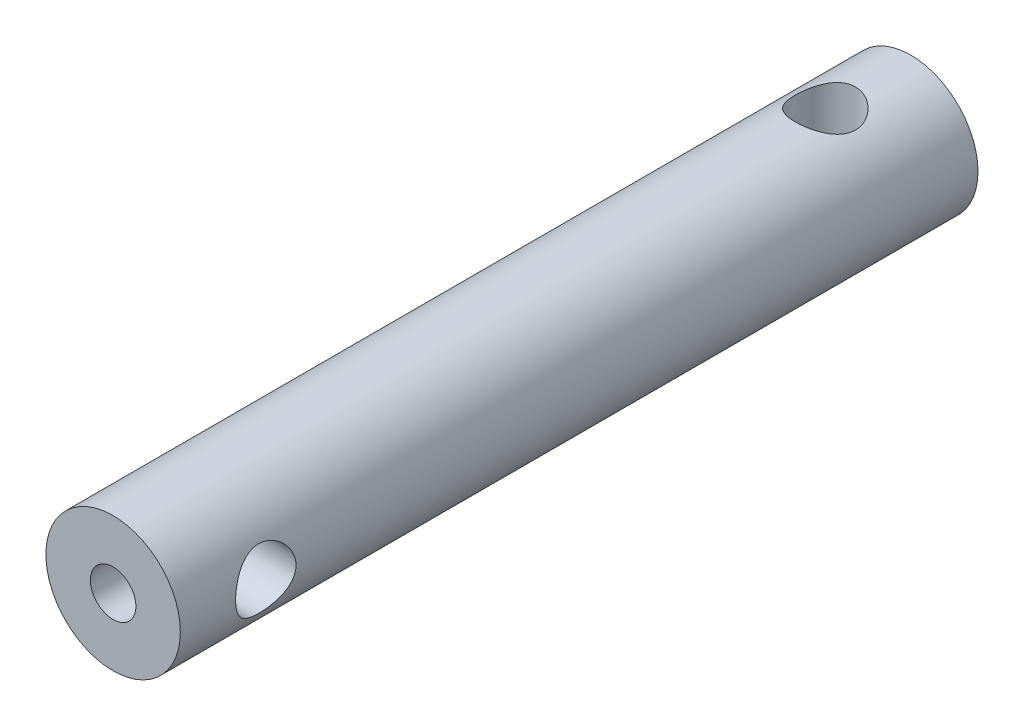
from build123d import *

# Parameters (mm, degrees)
SKETCH1_R               = 7.493
SKETCH1_R_2             = 2.54
BOSS_EXTRUDE1_DEPTH     = 88.9
CUT_EXTRUDE2_DEPTH      = 90.529325352
CUT_EXTRUDE2_DEPTH_BACK = 90.529325352
SKETCH7_R               = 3.3655
CUT_EXTRUDE3_DEPTH      = 90.529325468
CUT_EXTRUDE3_DEPTH_BACK = 90.529325468
SKETCH8_R               = 3.3655


with BuildPart() as part:
    # Sketch1 → Boss-Extrude1 (new body)
    with BuildSketch(Plane.XY):
        Circle(SKETCH1_R)
        Circle(SKETCH1_R_2, mode=Mode.SUBTRACT)
    extrude(amount=BOSS_EXTRUDE1_DEPTH)

    # Sketch7 → Cut-Extrude2 (cut, two sides: drawn at the far end of the back side and taken through both)
    with BuildSketch(Plane(origin=(0, 0, 0), x_dir=(1, 0, 0), z_dir=(0, 1, 0)).offset(-CUT_EXTRUDE2_DEPTH_BACK)):
        with Locations(Location((0, -9.525, 0), (0, 0, 270))):
            Circle(SKETCH7_R)
    extrude(amount=CUT_EXTRUDE2_DEPTH + CUT_EXTRUDE2_DEPTH_BACK, mode=Mode.SUBTRACT)

    # Sketch8 → Cut-Extrude3 (cut, two sides: drawn at the far end of the back side and taken through both)
    with BuildSketch(Plane(origin=(0, 0, 0), x_dir=(0, 0, -1), z_dir=(1, 0, 0)).offset(-CUT_EXTRUDE3_DEPTH_BACK)):
        with Locations((-79.375, 0)):
            Circle(SKETCH8_R)
    extrude(amount=CUT_EXTRUDE3_DEPTH + CUT_EXTRUDE3_DEPTH_BACK, mode=Mode.SUBTRACT)


solid = part.part
